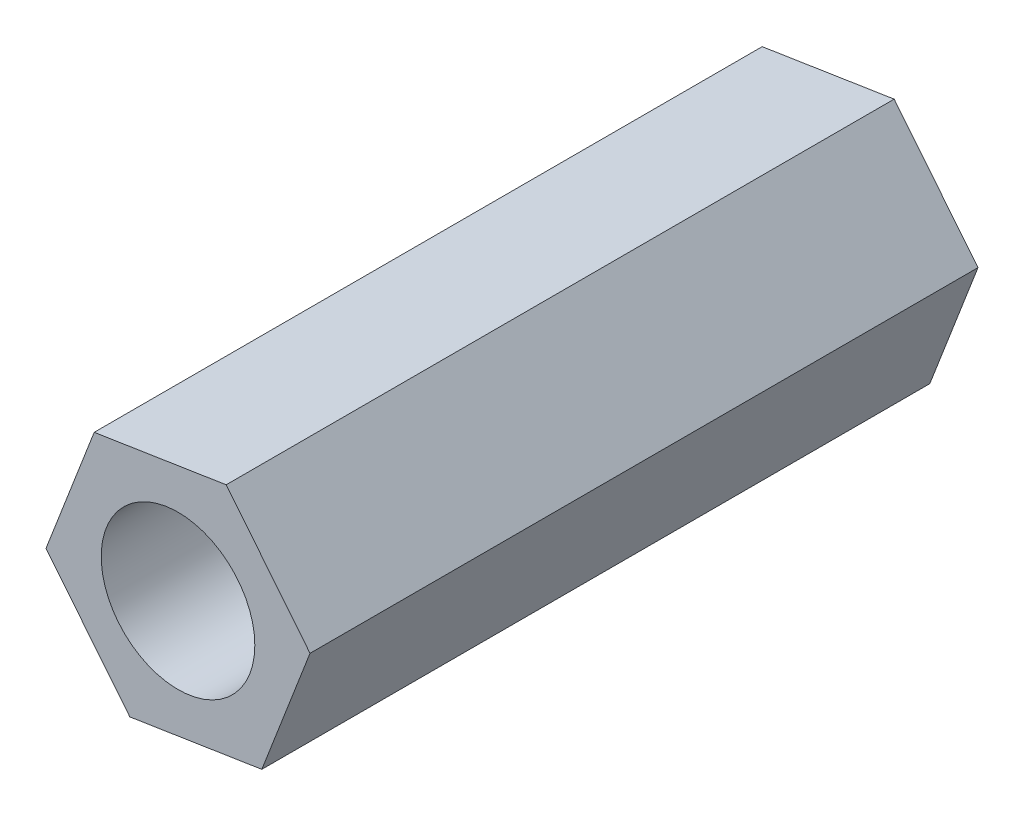
from build123d import *

# Parameters (mm, degrees)
SKETCH_1_R             = 5.75
EXTRUDE_1_DEPTH        = 50
HOLE_WIZARD_M5_1_D     = 4.2
HOLE_WIZARD_M5_1_DEPTH = 12.4
HOLE_WIZARD_M5_1_TIP   = 1.2618073


with BuildPart() as part:
    # 草图1 → 凸台-拉伸1 (new body)
    with BuildSketch(Plane.XY):
        Polygon((6.273575685, -7.78731328), (9.88079897, 1.539419276), (3.607223285, 9.326732556), (-6.273575685, 7.78731328), (-9.88079897, -1.539419276), (-3.607223285, -9.326732556), align=None)
        Circle(SKETCH_1_R, mode=Mode.SUBTRACT)
    extrude(amount=EXTRUDE_1_DEPTH)

    # M5 螺纹孔1
    with Locations(Plane(origin=(-6.744011128, -5.433075916, 0), x_dir=(0, 0, 1), z_dir=(-0.7787313279896286, -0.6273575685424616, 0))):
        with Locations((9.322042098, 0)):
            Hole(HOLE_WIZARD_M5_1_D / 2, depth=HOLE_WIZARD_M5_1_DEPTH)
            with Locations((0, 0, -(HOLE_WIZARD_M5_1_DEPTH + HOLE_WIZARD_M5_1_TIP / 2))):  # 118° drill point
                Cone(0, HOLE_WIZARD_M5_1_D / 2, HOLE_WIZARD_M5_1_TIP, mode=Mode.SUBTRACT)


solid = part.part
